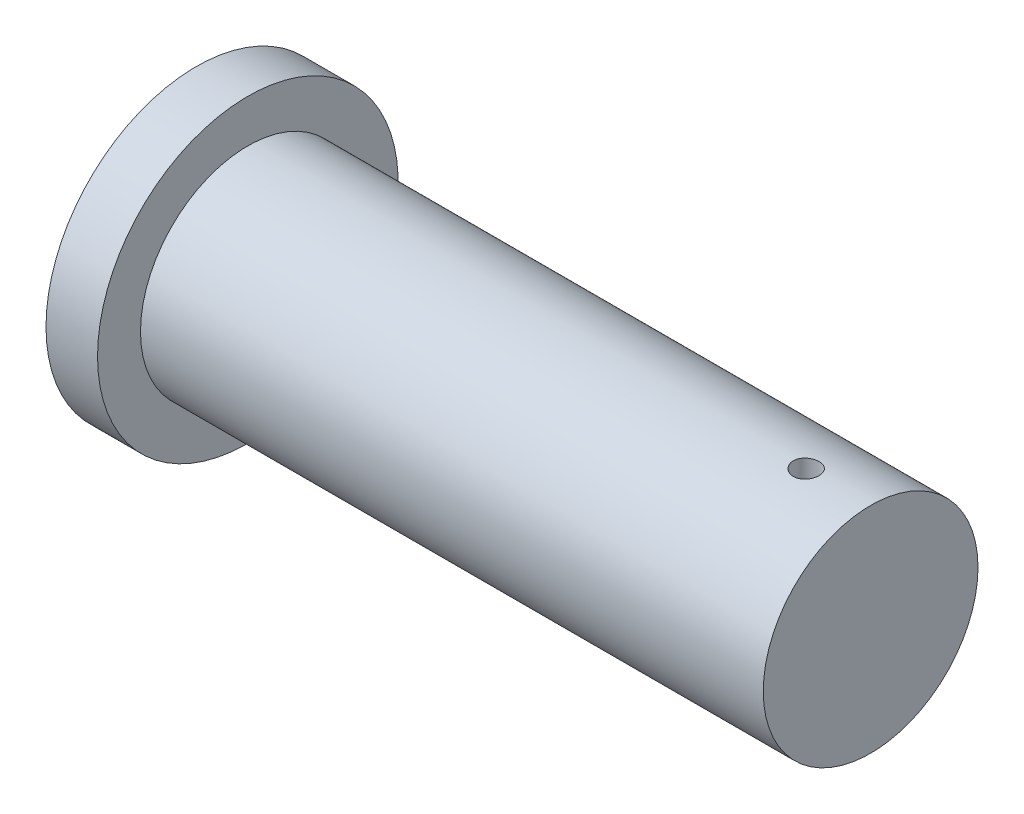
from build123d import *

# Parameters (mm, degrees)
CUT_EXTRUDE1_DEPTH      = 165.61773902
CUT_EXTRUDE1_DEPTH_BACK = 165.61773902
SKETCH2_R               = 3


with BuildPart() as part:
    # Sketch1 → Revolve1 (revolve)
    with BuildSketch(Plane.XY, mode=Mode.PRIVATE) as revolve1_sk:
        Polygon((0, 0), (0, 25), (-145, 25), (-145, 35), (-157, 35), (-157, 0), align=None)
    revolve(revolve1_sk.sketch.rotate(Axis((-157, 0, 0), (1, 0, 0)), 90), axis=Axis((-157, 0, 0), (1, 0, 0)))

    # Sketch2 → Cut-Extrude1 (cut, two sides: drawn at the far end of the back side and taken through both)
    with BuildSketch(Plane(origin=(0, 0, 0), x_dir=(1, 0, 0), z_dir=(0, 1, 0)).offset(-CUT_EXTRUDE1_DEPTH_BACK)):
        with Locations(Location((-15, 0, 0), (0, 0, 270))):
            Circle(SKETCH2_R)
    extrude(amount=CUT_EXTRUDE1_DEPTH + CUT_EXTRUDE1_DEPTH_BACK, mode=Mode.SUBTRACT)


solid = part.part
